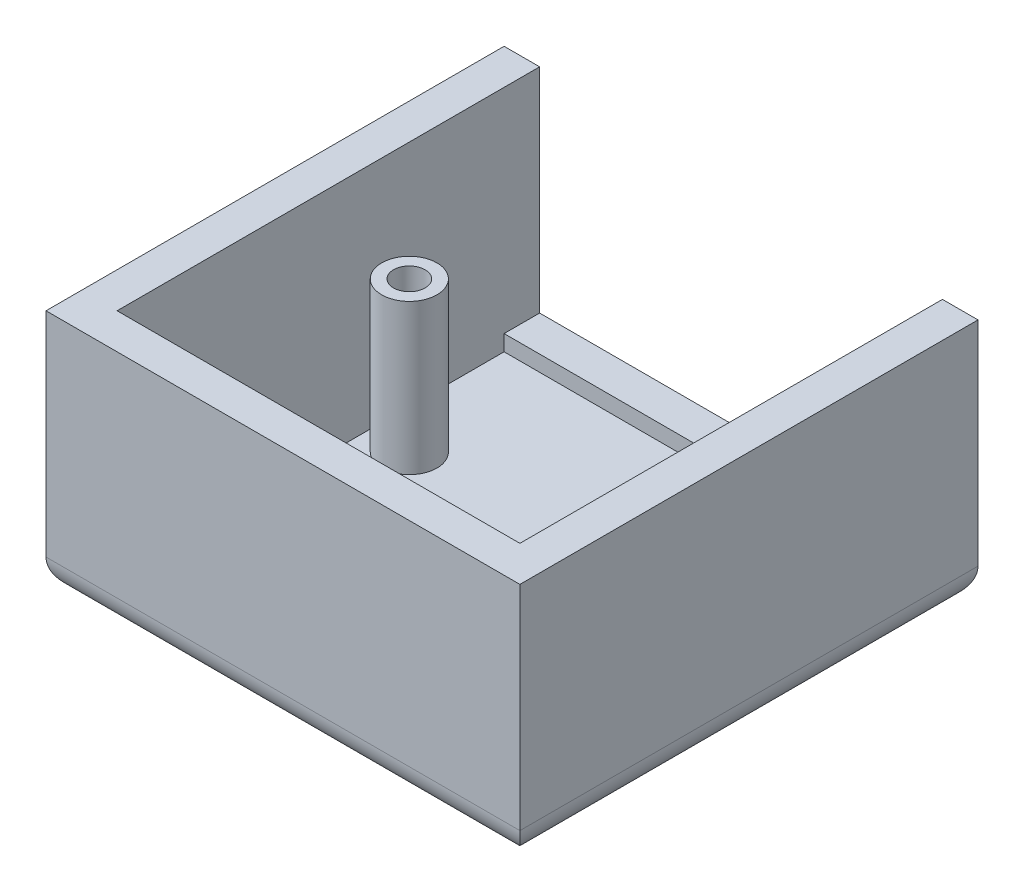
from build123d import *

# Parameters (mm, degrees)
CROQUIS1_W                 = 30
CROQUIS1_H                 = 29
SALIENTE_EXTRUIR1_DEPTH    = 15.5
CROQUIS2_W                 = 25.5
CROQUIS2_H                 = 24.5
CORTAR_EXTRUIR1_DEPTH      = 14.5
REDONDEO1_R                = 2
CROQUIS5_R                 = 6
CORTAR_EXTRUIR3_DEPTH      = 5
CORTAR_EXTRUIR5_DEPTH      = 0.75
CORTAR_EXTRUIR5_DEPTH_BACK = 3
CROQUIS6_W                 = 25.5
CROQUIS6_H                 = 13.5
CROQUIS3_R                 = 1.75
CROQUIS3_R_2               = 1
SALIENTE_EXTRUIR2_DEPTH    = 9.5


with BuildPart() as part:
    # Croquis1 → Saliente-Extruir1 (new body)
    with BuildSketch(Plane(origin=(0, 0, 0), x_dir=(1, 0, 0), z_dir=(0, 1, 0))):
        Rectangle(CROQUIS1_W, CROQUIS1_H)
    extrude(amount=SALIENTE_EXTRUIR1_DEPTH)

    # Croquis2 → Cortar-Extruir1 (cut)
    with BuildSketch(Plane(origin=(0, 15.5, 0), x_dir=(1, 0, 0), z_dir=(0, 1, 0))):
        Rectangle(CROQUIS2_W, CROQUIS2_H)
    extrude(amount=-CORTAR_EXTRUIR1_DEPTH, mode=Mode.SUBTRACT)

    # Redondeo1
    redondeo1_edges = [part.edges().sort_by_distance(p)[0] for p in [
        (0, 0, -14.5),
        (15, 0, 0),
        (0, 0, 14.5),
        (-15, 0, 0),
    ]]
    fillet(redondeo1_edges, radius=REDONDEO1_R)

    # Croquis5 → Cortar-Extruir3 (cut)
    with BuildSketch(Plane(origin=(0, 1, 0), x_dir=(1, 0, 0), z_dir=(0, 1, 0))):
        with Locations(Location((0, -3.907682746, 0), (0, 0, 270))):
            Circle(CROQUIS5_R)
    extrude(amount=-CORTAR_EXTRUIR3_DEPTH, mode=Mode.SUBTRACT)

    # Croquis6 → Cortar-Extruir5 (cut, two sides: drawn at the far end of the back side and taken through both)
    with BuildSketch(Plane(origin=(0, 0, -14.5), x_dir=(-1, 0, 0), z_dir=(0, 0, -1)).offset(-CORTAR_EXTRUIR5_DEPTH_BACK)):
        with Locations((0, 8.75)):
            Rectangle(CROQUIS6_W, CROQUIS6_H)
    extrude(amount=CORTAR_EXTRUIR5_DEPTH + CORTAR_EXTRUIR5_DEPTH_BACK, mode=Mode.SUBTRACT)

    # Croquis3 → Saliente-Extruir2 (add)
    # profile 1 of 4: a face of its own
    with BuildSketch(Plane(origin=(0, 1, 0), x_dir=(1, 0, 0), z_dir=(0, 1, 0))):
        with Locations(Location((10.25, -9.75, 0), (0, 0, 90))):
            Circle(CROQUIS3_R)
        with Locations(Location((10.25, -9.75, 0), (0, 0, 270))):
            Circle(CROQUIS3_R_2, mode=Mode.SUBTRACT)
    # profile 2 of 4: a face of its own
    with BuildSketch(Plane(origin=(0, 1, 0), x_dir=(1, 0, 0), z_dir=(0, 1, 0))):
        with Locations(Location((10.25, 3.75, 0), (0, 0, 90))):
            Circle(CROQUIS3_R)
        with Locations(Location((10.25, 3.75, 0), (0, 0, 270))):
            Circle(CROQUIS3_R_2, mode=Mode.SUBTRACT)
    # profile 3 of 4: a face of its own
    with BuildSketch(Plane(origin=(0, 1, 0), x_dir=(1, 0, 0), z_dir=(0, 1, 0))):
        with Locations(Location((-10.25, 3.75, 0), (0, 0, 90))):
            Circle(CROQUIS3_R)
        with Locations(Location((-10.25, 3.75, 0), (0, 0, 90))):
            Circle(CROQUIS3_R_2, mode=Mode.SUBTRACT)
    # profile 4 of 4: a face of its own
    with BuildSketch(Plane(origin=(0, 1, 0), x_dir=(1, 0, 0), z_dir=(0, 1, 0))):
        with Locations(Location((-10.25, -9.75, 0), (0, 0, 90))):
            Circle(CROQUIS3_R)
        with Locations(Location((-10.25, -9.75, 0), (0, 0, 90))):
            Circle(CROQUIS3_R_2, mode=Mode.SUBTRACT)
    extrude(amount=SALIENTE_EXTRUIR2_DEPTH)


solid = part.part
